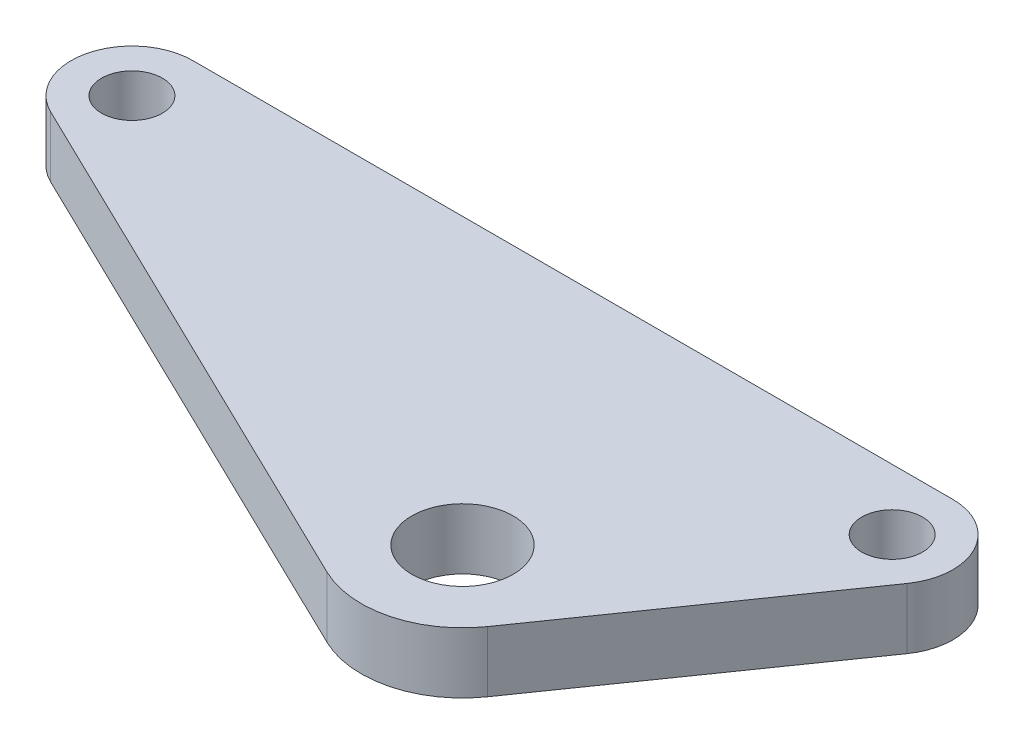
from build123d import *

# Parameters (mm, degrees)
SKETCH_1_R      = 5
SKETCH_1_R_2    = 3
EXTRUDE_1_DEPTH = 3


with BuildPart() as part:
    # 草图1 → 凸台-拉伸1 (new, symmetric)
    with BuildSketch(Plane(origin=(0, 0, 0), x_dir=(1, 0, 0), z_dir=(0, 1, 0))):
        with BuildLine():
            Line((-2.618938967, -5.398255152), (50.341768388, -31.091901768))
            ThreePointArc((50.341768388, -31.091901768), (57.228686361, -31.77155603), (62.907769529, -27.816864709))
            Line((62.907769529, -27.816864709), (79.920661718, -3.433232917))
            ThreePointArc((79.920661718, -3.433232917), (80.319746117, 2.774941666), (75, 6))
            Line((75, 6), (0, 6))
            ThreePointArc((0, 6), (-5.847629046, 1.34359017), (-2.618938967, -5.398255152))
        make_face()
        with Locations(Location((54.706666667, -22.094809848, 0), (0, 0, 270))):
            Circle(SKETCH_1_R, mode=Mode.SUBTRACT)
        with Locations(Location((75, 0, 0), (0, 0, 270))):
            Circle(SKETCH_1_R_2, mode=Mode.SUBTRACT)
        with Locations(Location((0, 0, 0), (0, 0, 270))):
            Circle(SKETCH_1_R_2, mode=Mode.SUBTRACT)
    extrude(amount=EXTRUDE_1_DEPTH, both=True)


solid = part.part
